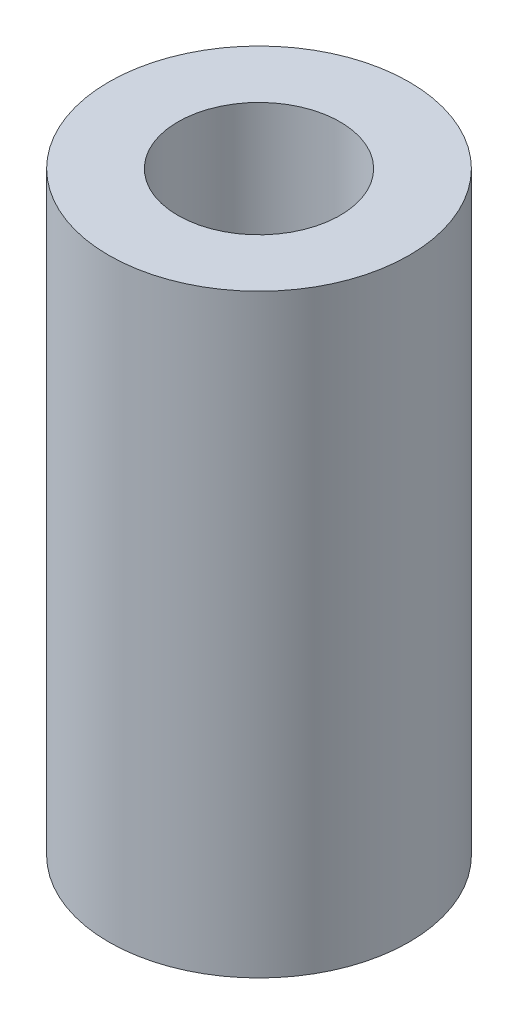
from build123d import *

# Parameters (mm, degrees)
SKETCH1_R           = 6.35
SKETCH1_R_2         = 3.429
BOSS_EXTRUDE1_DEPTH = 25.146


with BuildPart() as part:
    # Sketch1 → Boss-Extrude1 (new body)
    with BuildSketch(Plane(origin=(0, 0, 0), x_dir=(1, 0, 0), z_dir=(0, 1, 0))):
        with Locations(Location((0, 0, 0), (0, 0, 270))):
            Circle(SKETCH1_R)
        with Locations(Location((0, 0, 0), (0, 0, 270))):
            Circle(SKETCH1_R_2, mode=Mode.SUBTRACT)
    extrude(amount=BOSS_EXTRUDE1_DEPTH)


solid = part.part
